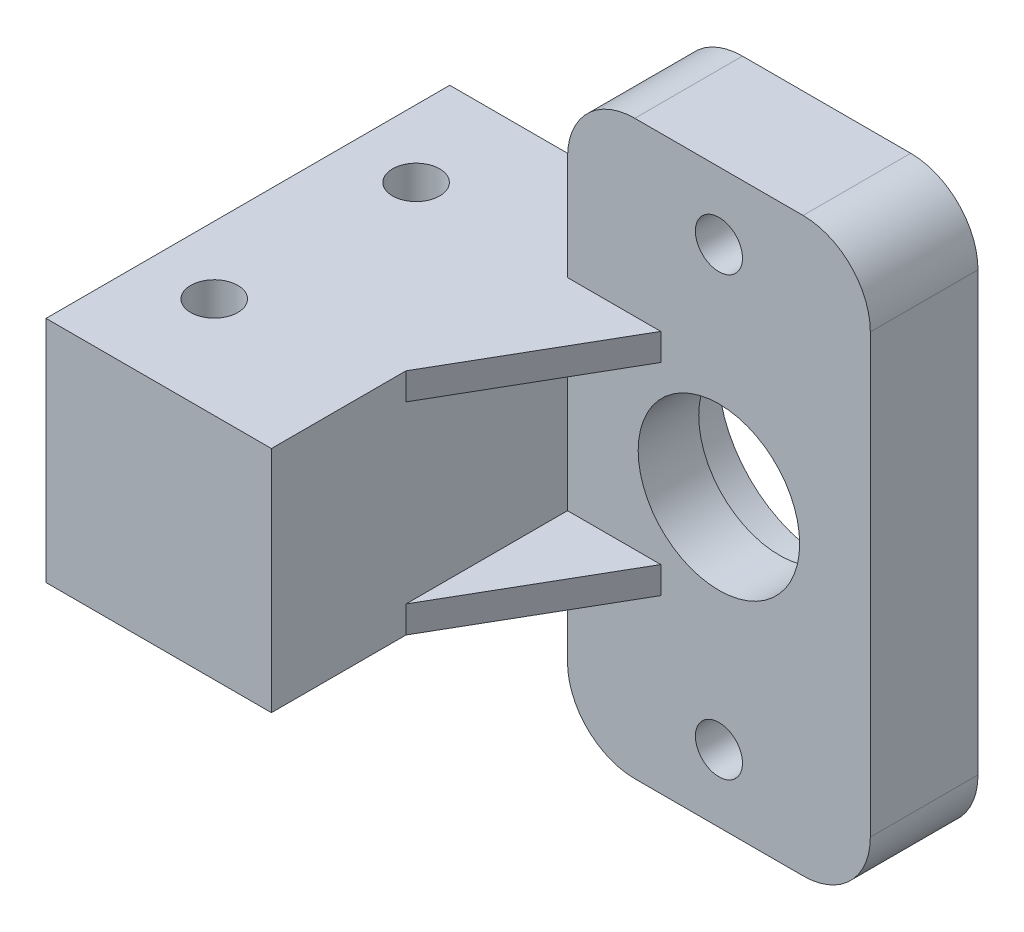
from build123d import *

# Parameters (mm, degrees)
SKETCH_2_R          = 1.75
SKETCH_2_R_2        = 6
EXTRUDE_1_DEPTH     = 8
SKETCH_3_R          = 8.05
CUT_EXTRUDE_1_DEPTH = 3.5
SKETCH_4_W          = 16.75
SKETCH_4_H          = 17
EXTRUDE_2_DEPTH     = 30
SKETCH_5_R          = 1.75
CUT_EXTRUDE_2_DEPTH = 51.685920136
EXTRUDE_3_DEPTH     = 2
EXTRUDE_4_DEPTH     = 2


with BuildPart() as part:
    # 草图2 → 凸台-拉伸1 (new body)
    with BuildSketch(Plane.XY):
        with BuildLine():
            Line((-6.25, 21.25), (6.25, 21.25))
            ThreePointArc((6.25, 21.25), (9.785533906, 19.785533906), (11.25, 16.25))
            Line((11.25, 16.25), (11.25, -16.25))
            ThreePointArc((11.25, -16.25), (9.785533906, -19.785533906), (6.25, -21.25))
            Line((6.25, -21.25), (-6.25, -21.25))
            ThreePointArc((-6.25, -21.25), (-9.785533906, -19.785533906), (-11.25, -16.25))
            Line((-11.25, -16.25), (-11.25, 16.25))
            ThreePointArc((-11.25, 16.25), (-9.785533906, 19.785533906), (-6.25, 21.25))
        make_face()
        with Locations((0, -16.25)):
            Circle(SKETCH_2_R, mode=Mode.SUBTRACT)
        Circle(SKETCH_2_R_2, mode=Mode.SUBTRACT)
        with Locations((0, 16.25)):
            Circle(SKETCH_2_R, mode=Mode.SUBTRACT)
    extrude(amount=EXTRUDE_1_DEPTH)

    # 草图3 → 切除-拉伸1 (cut)
    with BuildSketch(Plane(origin=(0, 0, 0), x_dir=(-1, 0, 0), z_dir=(0, 0, -1))):
        Circle(SKETCH_3_R)
    extrude(amount=-CUT_EXTRUDE_1_DEPTH, mode=Mode.SUBTRACT)

    # 草图4 → 凸台-拉伸2 (add)
    with BuildSketch(Plane.XY):
        with Locations((-19.625, 0)):
            Rectangle(SKETCH_4_W, SKETCH_4_H)
    extrude(amount=EXTRUDE_2_DEPTH)

    # 草图5 → 切除-拉伸2 (cut, through all)
    with BuildSketch(Plane.XZ.offset(8.5)):
        with Locations(Location((-23, 22.5, 0), (0, 0, 270))):
            Circle(SKETCH_5_R)
        with Locations(Location((-23, 7.5, 0), (0, 0, 270))):
            Circle(SKETCH_5_R)
    extrude(amount=-CUT_EXTRUDE_2_DEPTH, mode=Mode.SUBTRACT)

    # 草图7 → 凸台-拉伸3 (add)
    with BuildSketch(Plane.XZ.offset(8.5)):
        Polygon((-11.25, 20), (-11.25, 8), (-4.32179677, 8), align=None)
    extrude(amount=-EXTRUDE_3_DEPTH)

    # 草图8 → 凸台-拉伸4 (add)
    with BuildSketch(Plane(origin=(0, 8.5, 0), x_dir=(1, 0, 0), z_dir=(0, 1, 0))):
        Polygon((-4.32179677, -8), (-11.25, -20), (-11.25, -8), align=None)
    extrude(amount=-EXTRUDE_4_DEPTH)


solid = part.part
